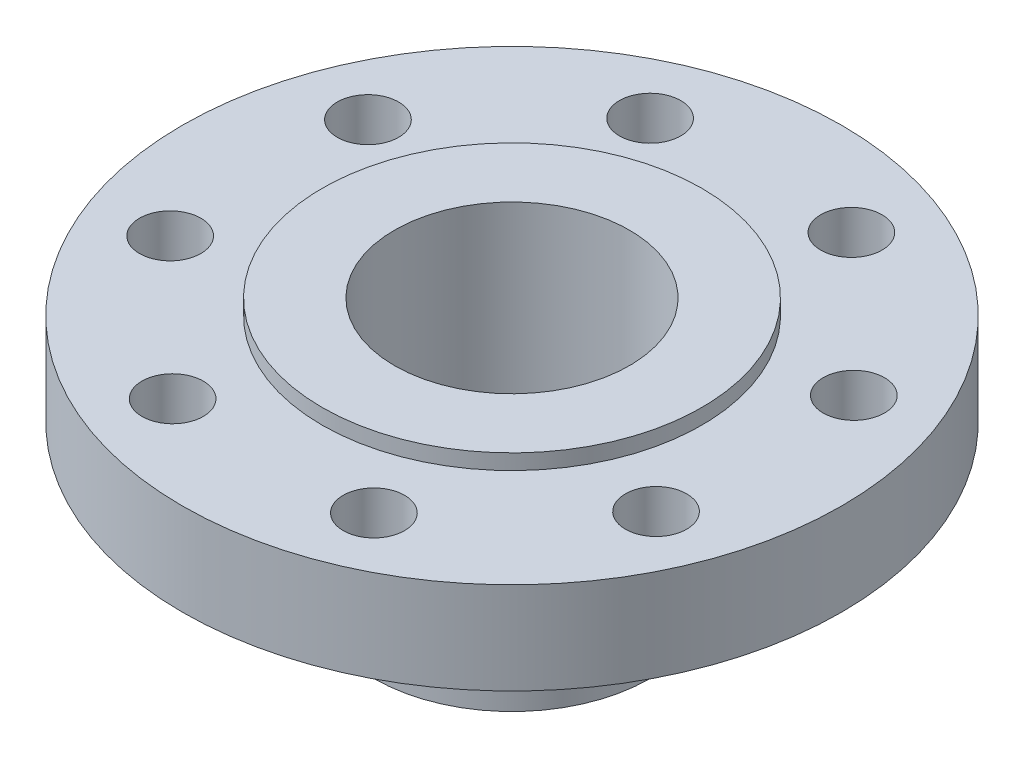
from build123d import *

# Parameters (mm, degrees)
SKETCH2_R          = 12.7
CUT_EXTRUDE1_DEPTH = 53


with BuildPart() as part:
    # Sketch1 → Revolve1 (revolve)
    with BuildSketch(Plane.XY, mode=Mode.PRIVATE) as revolve1_sk:
        Polygon((48.64, 0), (48.64, 107.95), (78.615, 107.95), (78.615, 101.6), (136.525, 101.6), (136.525, 63.5), (78.615, 63.5), (57.15, 11.29), (57.15, 0), align=None)
    revolve(revolve1_sk.sketch.rotate(Axis((0, 145.426192893, 0), (0, -1, 0)), 90), axis=Axis((0, 145.426192893, 0), (0, -1, 0)))

    # Sketch2 → Cut-Extrude1 (cut)
    with BuildSketch(Plane(origin=(0, 101.6, 0), x_dir=(1, 0, 0), z_dir=(0, 1, 0))):
        with Locations(Location((-42.17942532, 99.36849893, 0), (0, 0, 270))):
            Circle(SKETCH2_R)
        with Locations(Location((40.438781759, 100.0894971, 0), (0, 0, 270))):
            Circle(SKETCH2_R)
        with Locations(Location((99.36849893, 42.17942532, 0), (0, 0, 270))):
            Circle(SKETCH2_R)
        with Locations(Location((100.0894971, -40.438781759, 0), (0, 0, 270))):
            Circle(SKETCH2_R)
        with Locations(Location((42.17942532, -99.36849893, 0), (0, 0, 270))):
            Circle(SKETCH2_R)
        with Locations(Location((-40.438781759, -100.0894971, 0), (0, 0, 270))):
            Circle(SKETCH2_R)
        with Locations(Location((-99.36849893, -42.17942532, 0), (0, 0, 270))):
            Circle(SKETCH2_R)
        with Locations(Location((-100.0894971, 40.438781759, 0), (0, 0, 270))):
            Circle(SKETCH2_R)
    extrude(amount=-CUT_EXTRUDE1_DEPTH, mode=Mode.SUBTRACT)


solid = part.part
